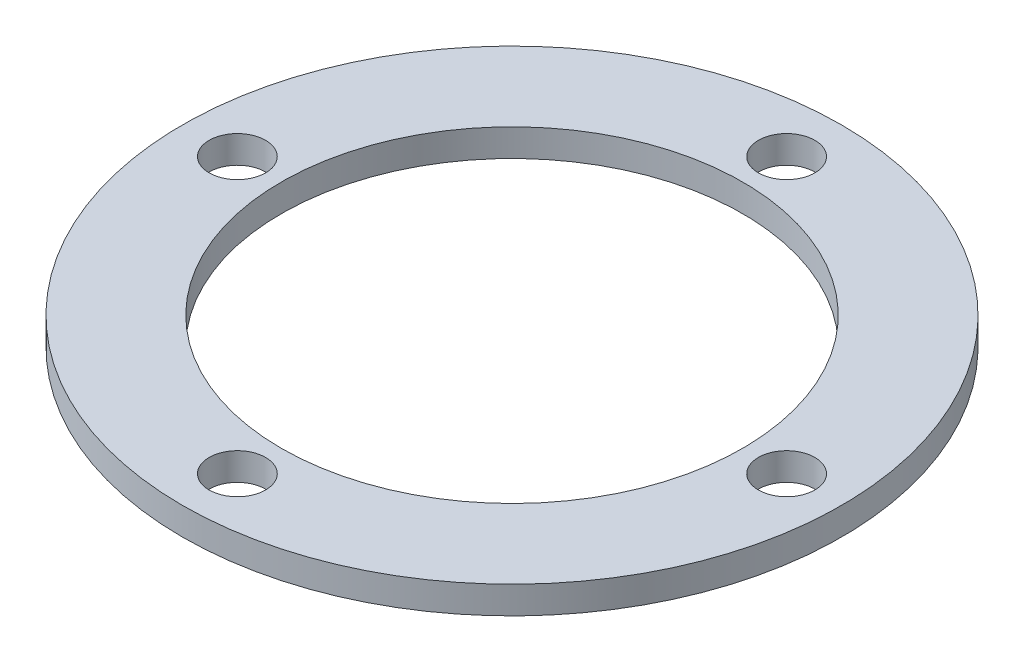
from build123d import *

# Parameters (mm, degrees)
SKETCH1_R           = 38.1
SKETCH1_R_2         = 26.67
SKETCH1_R_3         = 3.2639
BOSS_EXTRUDE1_DEPTH = 3.175


with BuildPart() as part:
    # Sketch1 → Boss-Extrude1 (new body)
    with BuildSketch(Plane(origin=(0, 0, 0), x_dir=(1, 0, 0), z_dir=(0, 1, 0))):
        with Locations(Location((0, 0, 0), (0, 0, 270))):
            Circle(SKETCH1_R)
        with Locations(Location((0, 0, 0), (0, 0, 270))):
            Circle(SKETCH1_R_2, mode=Mode.SUBTRACT)
        with Locations(Location((0, 31.75, 0), (0, 0, 270))):
            Circle(SKETCH1_R_3, mode=Mode.SUBTRACT)
        with Locations(Location((31.75, 0, 0), (0, 0, 270))):
            Circle(SKETCH1_R_3, mode=Mode.SUBTRACT)
        with Locations(Location((0, -31.75, 0), (0, 0, 270))):
            Circle(SKETCH1_R_3, mode=Mode.SUBTRACT)
        with Locations(Location((-31.75, 0, 0), (0, 0, 270))):
            Circle(SKETCH1_R_3, mode=Mode.SUBTRACT)
    extrude(amount=BOSS_EXTRUDE1_DEPTH)


solid = part.part
